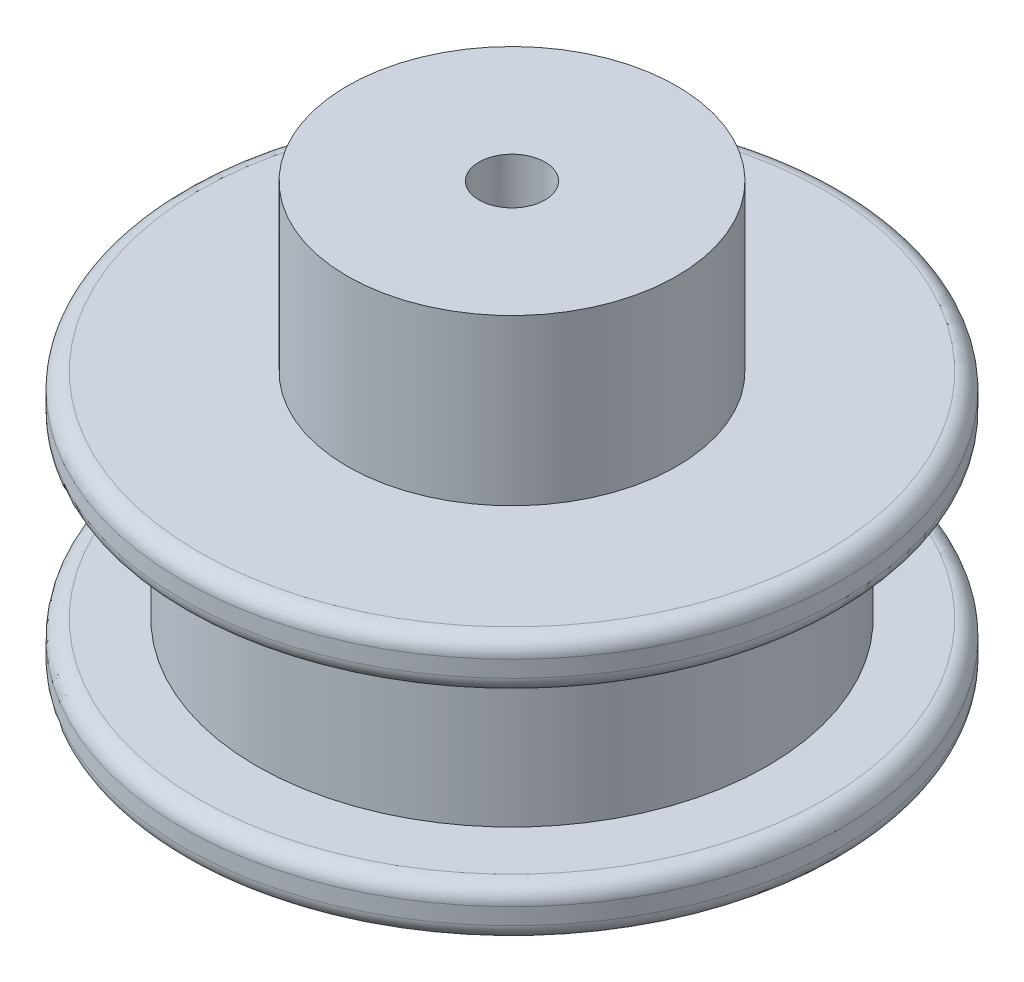
from build123d import *

# Parameters (mm, degrees)
SKETCH_1_R          = 15.5
EXTRUDE_1_DEPTH     = 10
SKETCH_2_R          = 20
EXTRUDE_2_DEPTH     = 3
EXTRUDE_START       = 3
SKETCH_3_R          = 20
EXTRUDE_3_DEPTH     = 3
FILLET_2_R          = 1
SKETCH_4_R          = 2
CUT_EXTRUDE_1_DEPTH = 33.49615368
EXTRUDE_START_2     = 10
SKETCH_5_R          = 10
SKETCH_5_R_2        = 2
EXTRUDE_4_DEPTH     = 10
SKETCH_6_R          = 2
CUT_EXTRUDE_2_DEPTH = 37.455452322


with BuildPart() as part:
    # 草图1 → 凸台-拉伸1 (new body)
    with BuildSketch(Plane(origin=(0, 0, 0), x_dir=(1, 0, 0), z_dir=(0, 1, 0))):
        with Locations(Location((0, 0, 0), (0, 0, 270))):
            Circle(SKETCH_1_R)
    extrude(amount=EXTRUDE_1_DEPTH)

    # 草图2 → 凸台-拉伸2 (add)
    with BuildSketch(Plane(origin=(0, 10, 0), x_dir=(1, 0, 0), z_dir=(0, 1, 0))):
        with Locations(Location((0, 0, 0), (0, 0, 270))):
            Circle(SKETCH_2_R)
    extrude(amount=EXTRUDE_2_DEPTH)

    # 草图3 → 凸台-拉伸3 (add)
    with BuildSketch(Plane.XZ.offset(EXTRUDE_START)):
        with Locations(Location((0, 0, 0), (0, 0, 90))):
            Circle(SKETCH_3_R)
    extrude(amount=-EXTRUDE_3_DEPTH)

    # 圆角2
    fillet_2_edges = [part.edges().sort_by_distance(p)[0] for p in [
        (0, -3, -20),
        (0, 10, -20),
        (0, 13, -20),
        (0, 0, -20),
    ]]
    fillet(fillet_2_edges, radius=FILLET_2_R)

    # 草图4 → 切除-拉伸1 (cut, through all)
    with BuildSketch(Plane(origin=(0, 13, 0), x_dir=(1, 0, 0), z_dir=(0, 1, 0))):
        with Locations(Location((0, 0, 0), (0, 0, 270))):
            Circle(SKETCH_4_R)
    extrude(amount=-CUT_EXTRUDE_1_DEPTH, mode=Mode.SUBTRACT)

    # 草图5 → 凸台-拉伸4 (add)
    with BuildSketch(Plane(origin=(0, 13, 0), x_dir=(1, 0, 0), z_dir=(0, 1, 0)).offset(EXTRUDE_START_2)):
        with Locations(Location((0, 0, 0), (0, 0, 270))):
            Circle(SKETCH_5_R)
        with Locations(Location((0, 0, 0), (0, 0, 270))):
            Circle(SKETCH_5_R_2, mode=Mode.SUBTRACT)
    extrude(amount=-EXTRUDE_4_DEPTH)

    # 草图6 → 切除-拉伸2 (cut, through all)
    with BuildSketch(Plane.XY):
        with Locations((0, 18.145224443)):
            Circle(SKETCH_6_R)
    extrude(amount=-CUT_EXTRUDE_2_DEPTH, mode=Mode.SUBTRACT)


solid = part.part
